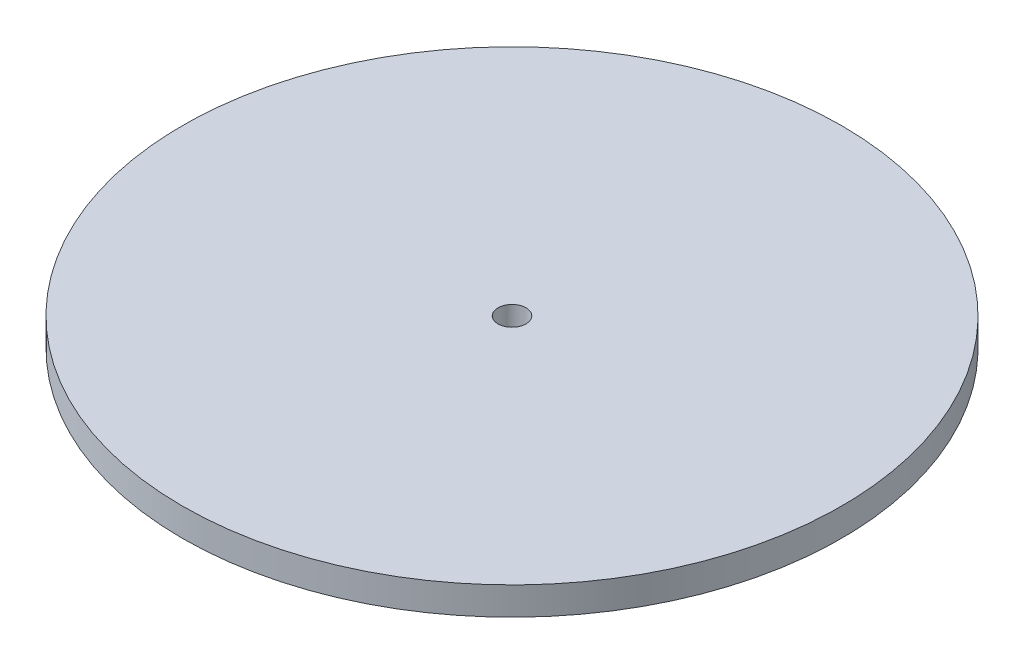
from build123d import *

# Parameters (mm, degrees)
SKETCH2_R           = 74.7776
BOSS_EXTRUDE1_DEPTH = 3.175
CUT_EXTRUDE1_REACH  = 107.942
SKETCH3_R           = 3.175


with BuildPart() as part:
    # Sketch2 → Boss-Extrude1 (new, symmetric)
    with BuildSketch(Plane(origin=(0, 0, 0), x_dir=(1, 0, 0), z_dir=(0, 1, 0))):
        with Locations(Location((0, 0, 0), (0, 0, 270))):
            Circle(SKETCH2_R)
    extrude(amount=BOSS_EXTRUDE1_DEPTH, both=True)

    # Sketch3 → Cut-Extrude1 (cut, up to next)
    with BuildSketch(Plane(origin=(0, 3.175, 0), x_dir=(1, 0, 0), z_dir=(0, 1, 0)), mode=Mode.PRIVATE) as cut_extrude1_sk1:
        with Locations(Location((0, 0, 0), (0, 0, 270))):
            Circle(SKETCH3_R)
    cut_extrude1_tool1 = extrude(cut_extrude1_sk1.sketch, amount=-CUT_EXTRUDE1_REACH, mode=Mode.PRIVATE) & part.part
    add(cut_extrude1_tool1.solids().sort_by_distance((0, 3.175, 0))[0], mode=Mode.SUBTRACT)


solid = part.part
